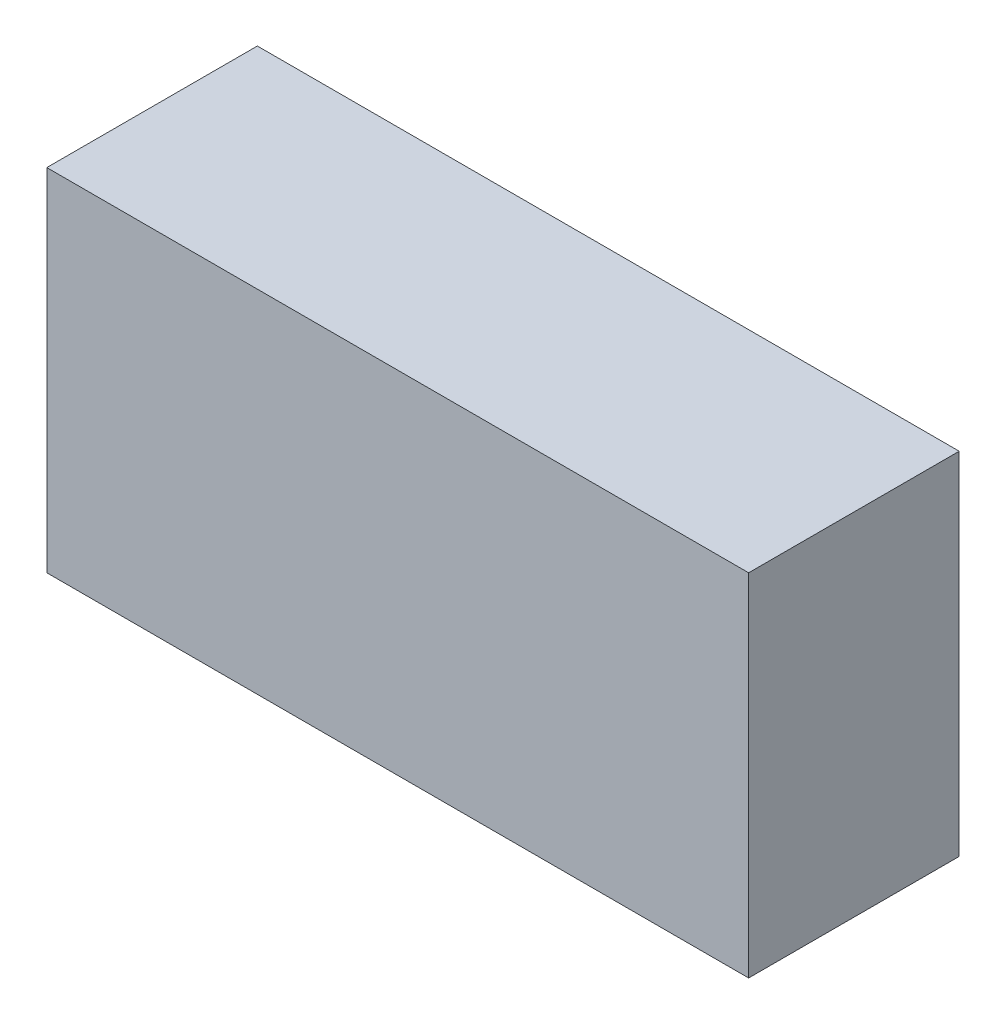
from build123d import *

# Parameters (mm, degrees)
SKETCH_1_W      = 100
SKETCH_1_H      = 50
EXTRUDE_1_DEPTH = 30


with BuildPart() as part:
    # Эскиз1 → Бобышка-Вытянуть1 (new body)
    with BuildSketch(Plane.XY):
        Rectangle(SKETCH_1_W, SKETCH_1_H)
    extrude(amount=EXTRUDE_1_DEPTH)


solid = part.part
